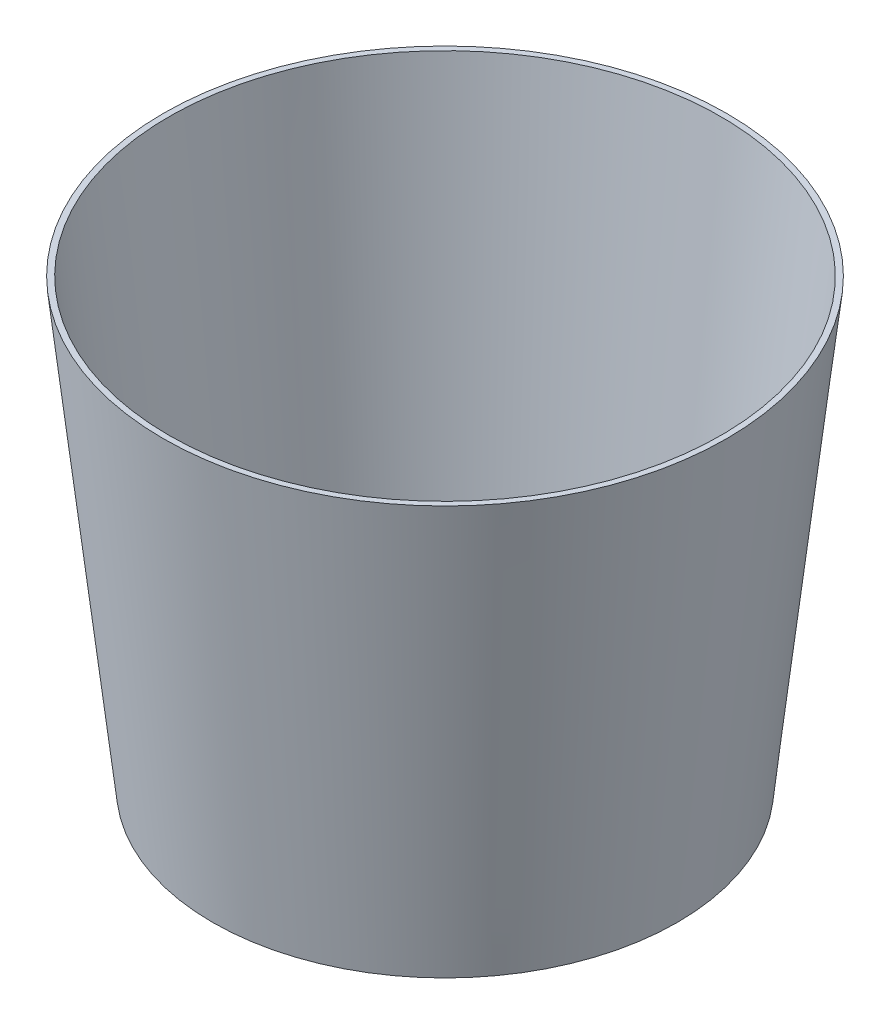
from build123d import *


with BuildPart() as part:
    # 草图10 → 旋转1 (revolve)
    with BuildSketch(Plane(origin=(0, 0, 0), x_dir=(0, 0, -1), z_dir=(1, 0, 0))):
        Polygon((-23.577185417, -17.412060302), (-23, -17.412060302), (-28, 27.587939698), (-28.577185417, 27.587939698), align=None)
    revolve(axis=Axis((0, 30.405580885, 0), (0, -1, 0)))


solid = part.part
